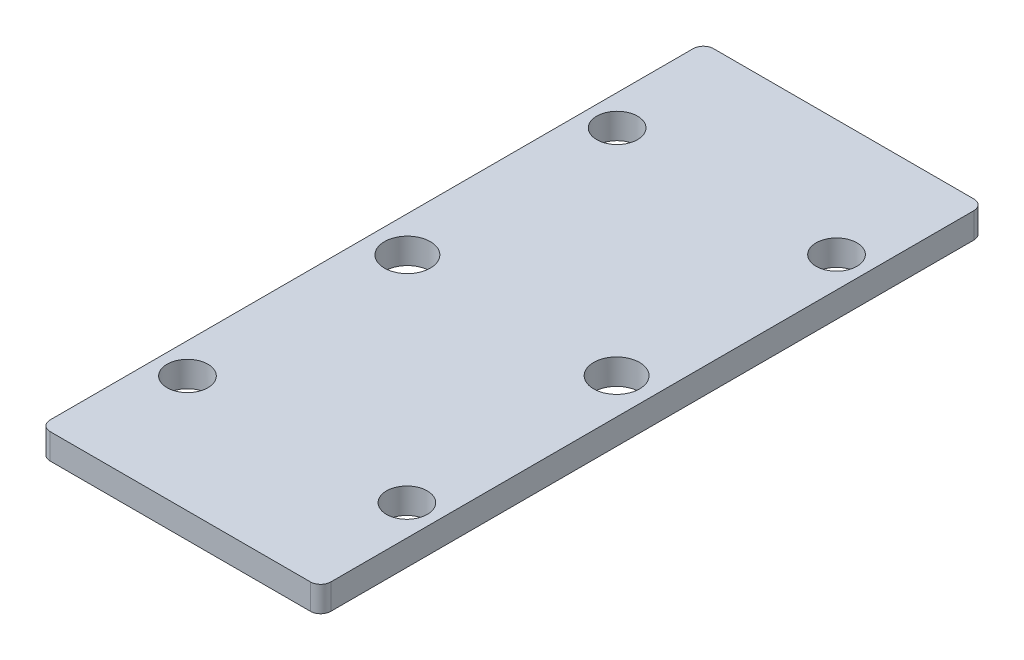
from build123d import *

# Parameters (mm, degrees)
SALIENTE_EXTRUIR1_DEPTH = 5
CROQUIS2_R              = 4.5
CROQUIS2_R_2            = 4
CORTAR_EXTRUIR1_DEPTH   = 10


with BuildPart() as part:
    # Croquis1 → Saliente-Extruir1 (new body)
    with BuildSketch(Plane(origin=(0, 0, 0), x_dir=(1, 0, 0), z_dir=(0, 1, 0))):
        with BuildLine():
            Line((-27.5, -63), (-27.5, 63))
            ThreePointArc((-27.5, 63), (-26.914213562, 64.414213562), (-25.5, 65))
            Line((-25.5, 65), (25.5, 65))
            ThreePointArc((25.5, 65), (26.914213562, 64.414213562), (27.5, 63))
            Line((27.5, 63), (27.5, -63))
            ThreePointArc((27.5, -63), (26.914213562, -64.414213562), (25.5, -65))
            Line((25.5, -65), (-25.5, -65))
            ThreePointArc((-25.5, -65), (-26.914213562, -64.414213562), (-27.5, -63))
        make_face()
    extrude(amount=SALIENTE_EXTRUIR1_DEPTH)

    # Croquis2 → Cortar-Extruir1 (cut)
    with BuildSketch(Plane(origin=(0, 5, 0), x_dir=(1, 0, 0), z_dir=(0, 1, 0))):
        with Locations(Location((-20.5, 0, 0), (0, 0, 270))):
            Circle(CROQUIS2_R)
        with Locations(Location((20.5, 0, 0), (0, 0, 270))):
            Circle(CROQUIS2_R)
        with Locations(Location((-21.5, 42.1, 0), (0, 0, 270))):
            Circle(CROQUIS2_R_2)
        with Locations(Location((-21.5, -42.1, 0), (0, 0, 270))):
            Circle(CROQUIS2_R_2)
        with Locations(Location((21.5, 42.1, 0), (0, 0, 270))):
            Circle(CROQUIS2_R_2)
        with Locations(Location((21.5, -42.1, 0), (0, 0, 270))):
            Circle(CROQUIS2_R_2)
    extrude(amount=-CORTAR_EXTRUIR1_DEPTH, mode=Mode.SUBTRACT)


solid = part.part
